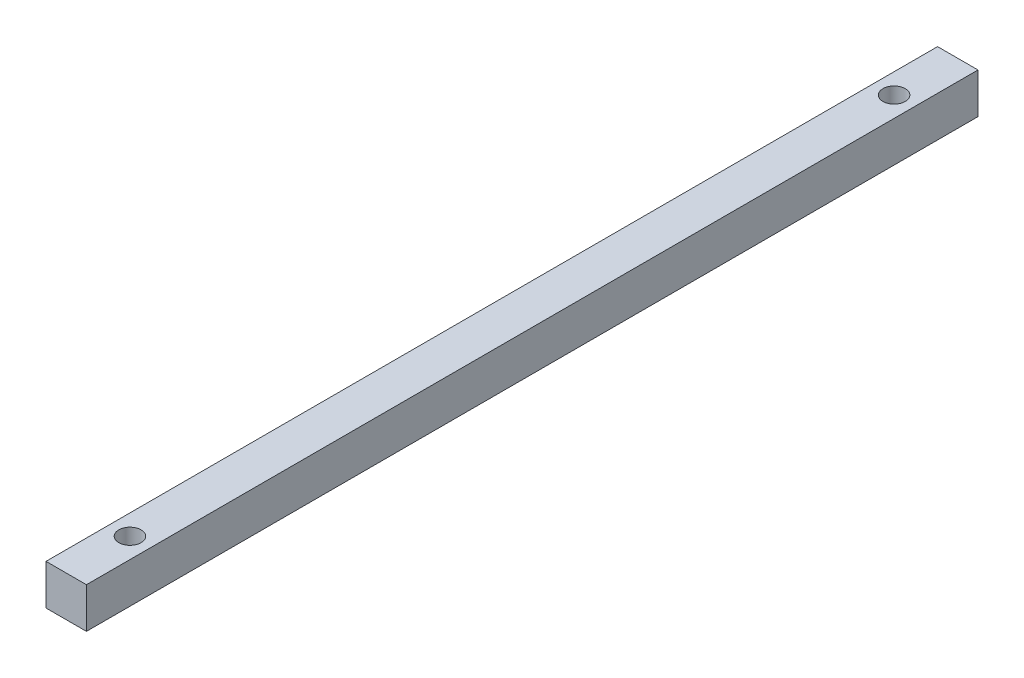
from build123d import *

# Parameters (mm, degrees)
BOSS_EXTRUDE1_DEPTH      = 609.6
BOSS_EXTRUDE1_DEPTH_BACK = 609.6
SKETCH3_W                = 6.35
SKETCH3_H                = 6.35
SKETCH4_W                = 7.35
SKETCH4_H                = 7.35
CUT_EXTRUDE1_DEPTH       = 1080.209340791
SKETCH5_R                = 1.75
CUT_EXTRUDE2_DEPTH       = 610.641339744


with BuildPart() as part:
    # Sketch3 → Boss-Extrude1 (new, two sides: drawn at the far end of the back side and taken through both)
    with BuildSketch(Plane.XY.offset(-BOSS_EXTRUDE1_DEPTH_BACK)):
        Rectangle(SKETCH3_W, SKETCH3_H)
    extrude(amount=BOSS_EXTRUDE1_DEPTH + BOSS_EXTRUDE1_DEPTH_BACK)

    # Sketch4 → Cut-Extrude1 (cut, through all)
    with BuildSketch(Plane(origin=(0, 0, -469.6), x_dir=(-1, 0, 0), z_dir=(0, 0, -1))):
        Rectangle(SKETCH4_W, SKETCH4_H)
    extrude(amount=-CUT_EXTRUDE1_DEPTH, mode=Mode.SUBTRACT)

    # Sketch5 → Cut-Extrude2 (cut, through all)
    with BuildSketch(Plane(origin=(0, 3.175, 0), x_dir=(1, 0, 0), z_dir=(0, 1, 0))):
        with Locations(Location((0, 599.6, 0), (0, 0, 270))):
            Circle(SKETCH5_R)
        with Locations(Location((0, 479.6, 0), (0, 0, 270))):
            Circle(SKETCH5_R)
    extrude(amount=-CUT_EXTRUDE2_DEPTH, mode=Mode.SUBTRACT)


solid = part.part
